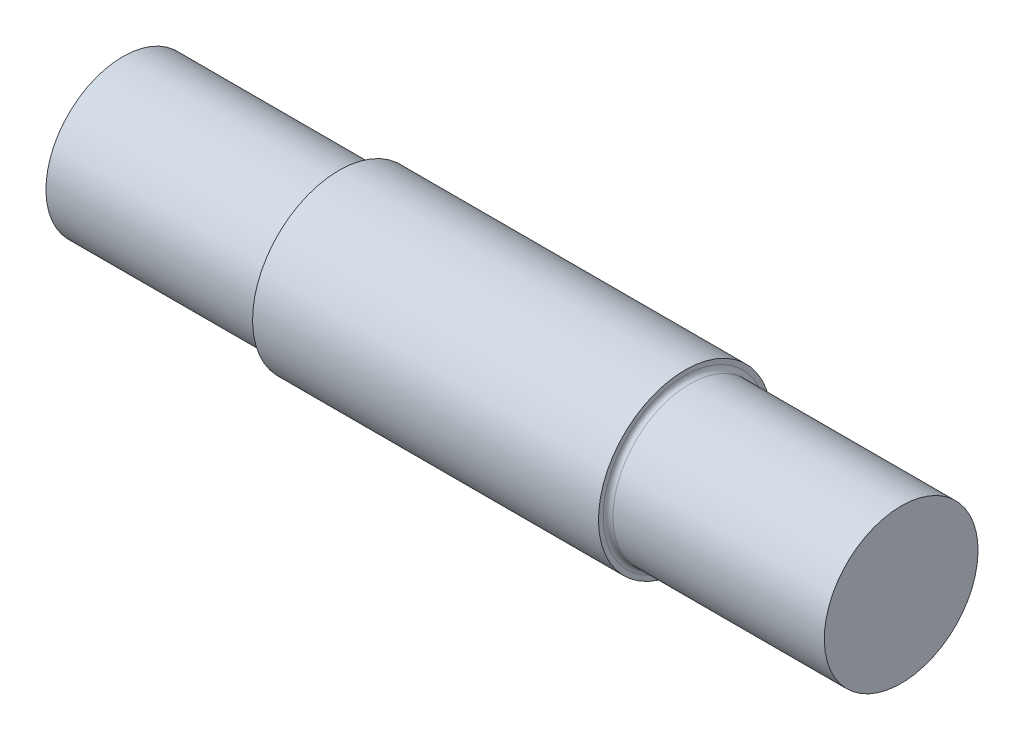
from build123d import *

# Parameters (mm, degrees)
RADYUS2_R = 0.5


with BuildPart() as part:
    # Çizim1 → Döndür2 (revolve)
    with BuildSketch(Plane.XY):
        Polygon((0, 0), (0, 8), (22.5, 8), (22.5, 9), (58.5, 9), (58.5, 8), (81, 8), (81, 0), align=None)
    revolve(axis=Axis((81, 0, 0), (-1, 0, 0)))

    # Radyus2
    radyus2_edges = [part.edges().sort_by_distance(p)[0] for p in [
        (58.5, -8, 0),
        (22.5, -8, 0),
    ]]
    fillet(radyus2_edges, radius=RADYUS2_R)


solid = part.part
